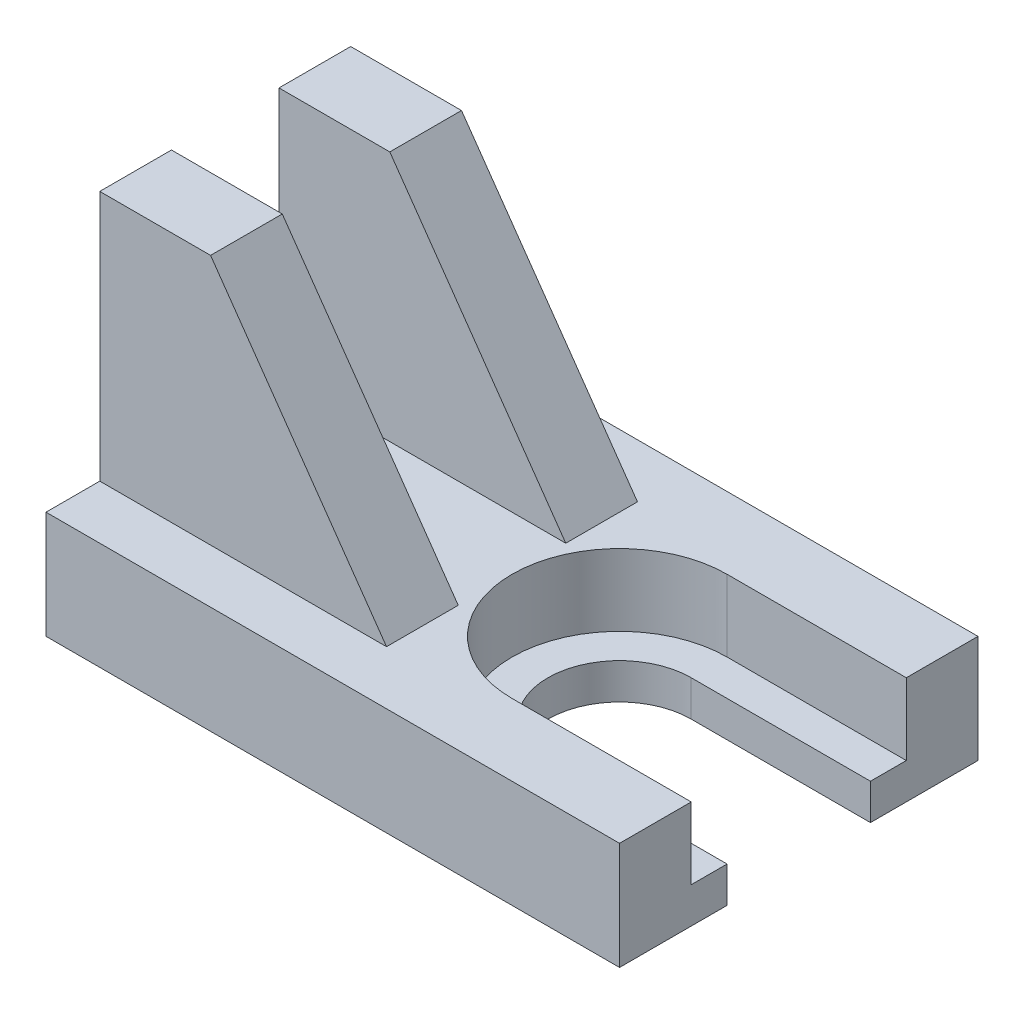
from build123d import *

# Parameters (mm, degrees)
SKETCH1_W           = 80
SKETCH1_H           = 50
BOSS_EXTRUDE1_DEPTH = 15
CUT_EXTRUDE2_DEPTH  = 10
CUT_EXTRUDE3_DEPTH  = 10
BOSS_EXTRUDE2_DEPTH = 10


with BuildPart() as part:
    # Sketch1 → Boss-Extrude1 (new body)
    with BuildSketch(Plane(origin=(0, 0, 0), x_dir=(1, 0, 0), z_dir=(0, 1, 0))):
        Rectangle(SKETCH1_W, SKETCH1_H)
    extrude(amount=BOSS_EXTRUDE1_DEPTH)

    # Sketch6 → Cut-Extrude2 (cut)
    with BuildSketch(Plane(origin=(0, 15, 0), x_dir=(1, 0, 0), z_dir=(0, 1, 0))):
        with BuildLine():
            Line((40, -15), (15, -15))
            ThreePointArc((15, -15), (0, 0), (15, 15))
            Line((15, 15), (40, 15))
            Line((40, 15), (40, -15))
        make_face()
    extrude(amount=-CUT_EXTRUDE2_DEPTH, mode=Mode.SUBTRACT)

    # Sketch8 → Cut-Extrude3 (cut)
    with BuildSketch(Plane(origin=(0, 5, 0), x_dir=(1, 0, 0), z_dir=(0, 1, 0))):
        with BuildLine():
            Line((40, -10), (15, -10))
            ThreePointArc((15, -10), (5, 0), (15, 10))
            Line((15, 10), (40, 10))
            Line((40, 10), (40, -10))
        make_face()
    extrude(amount=-CUT_EXTRUDE3_DEPTH, mode=Mode.SUBTRACT)

    # Sketch9 → Boss-Extrude2 (add)
    with BuildSketch(Plane.XY.offset(17.5)):
        Polygon((-40, 15), (-40, 50), (-24.543301065, 50), (0, 15), align=None)
    boss_extrude2 = extrude(amount=-BOSS_EXTRUDE2_DEPTH)

    # Mirror1: Boss-Extrude2 across plane
    add(boss_extrude2.mirror(Plane.XY))


solid = part.part
